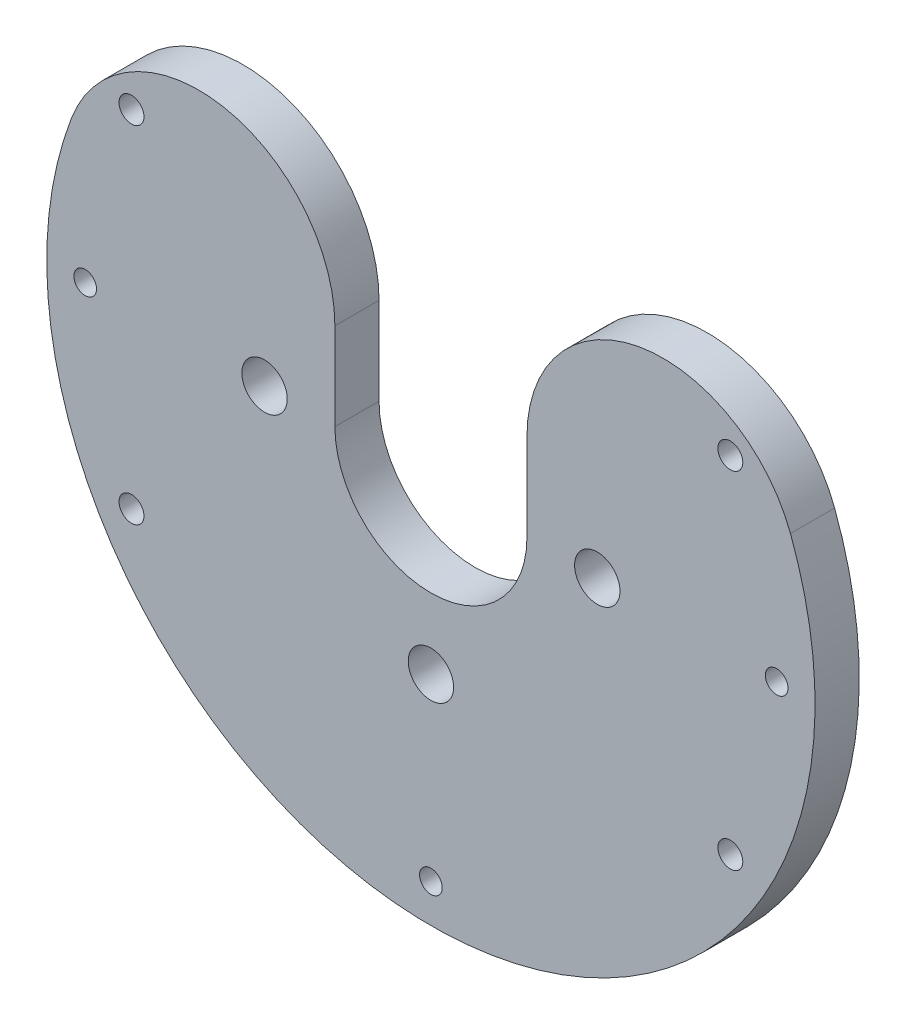
from build123d import *

# Parameters (mm, degrees)
SKETCH1_R           = 3
SKETCH1_R_2         = 1.5
SKETCH1_R_3         = 1.65
BOSS_EXTRUDE1_DEPTH = 5.842
FILLET1_R           = 18


with BuildPart() as part:
    # Sketch1 → Boss-Extrude1 (new body)
    with BuildSketch(Plane.XY):
        with BuildLine():
            Line((-12.7, 0), (-12.7, 49.186888497))
            ThreePointArc((-12.7, 49.186888497), (0, -50.8), (12.7, 49.186888497))
            Line((12.7, 49.186888497), (12.7, 0))
            ThreePointArc((12.7, 0), (0, -12.7), (-12.7, 0))
        make_face()
        with Locations((22, 0)):
            Circle(SKETCH1_R, mode=Mode.SUBTRACT)
        with Locations((0, -22)):
            Circle(SKETCH1_R, mode=Mode.SUBTRACT)
        with Locations((-22, 0)):
            Circle(SKETCH1_R, mode=Mode.SUBTRACT)
        with Locations((-45.72, 0)):
            Circle(SKETCH1_R_2, mode=Mode.SUBTRACT)
        with Locations((45.72, 0)):
            Circle(SKETCH1_R_2, mode=Mode.SUBTRACT)
        with Locations((0, -45.72)):
            Circle(SKETCH1_R_2, mode=Mode.SUBTRACT)
        with Locations((39.594681461, 22.86)):
            Circle(SKETCH1_R_3, mode=Mode.SUBTRACT)
        with Locations((39.594681461, -22.86)):
            Circle(SKETCH1_R_3, mode=Mode.SUBTRACT)
        with Locations((-39.594681461, -22.86)):
            Circle(SKETCH1_R_3, mode=Mode.SUBTRACT)
        with Locations((-39.594681461, 22.86)):
            Circle(SKETCH1_R_3, mode=Mode.SUBTRACT)
    extrude(amount=BOSS_EXTRUDE1_DEPTH)

    # Fillet1
    fillet1_edges = [part.edges().sort_by_distance(p)[0] for p in [
        (12.7, 49.186888497, 2.921),
        (-12.7, 49.186888497, 2.921),
    ]]
    fillet(fillet1_edges, radius=FILLET1_R)


solid = part.part
